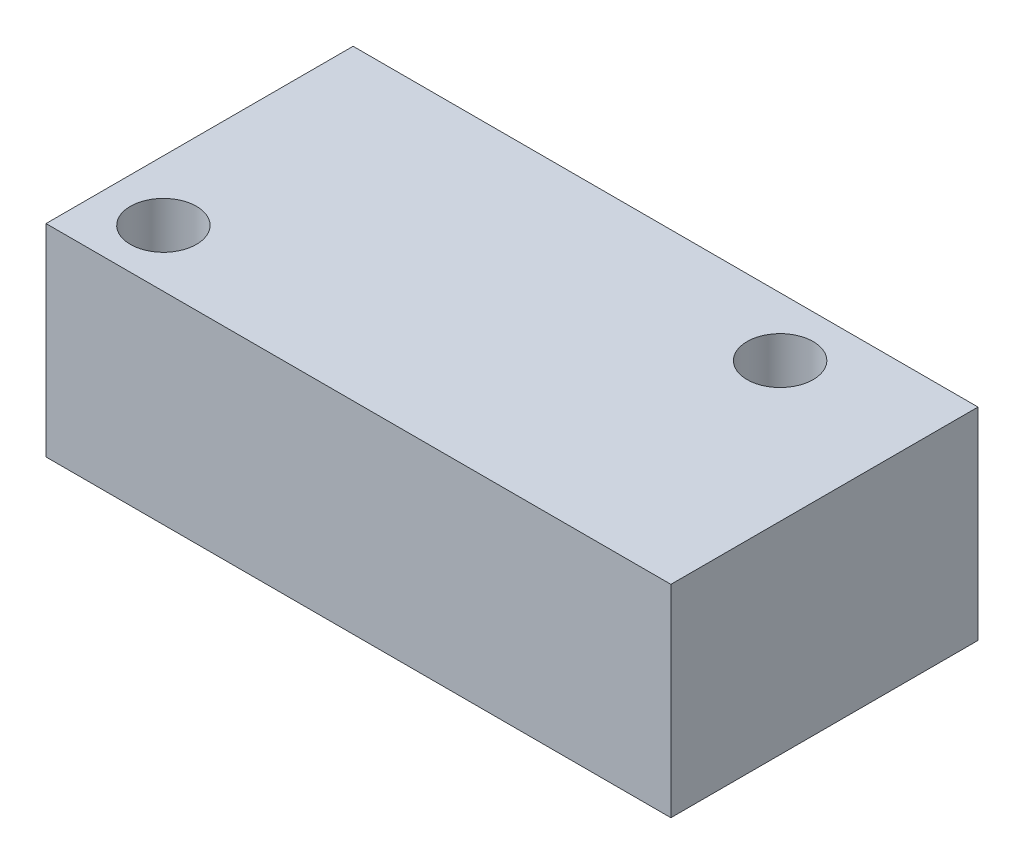
from build123d import *

# Parameters (mm, degrees)
SKETCH2_W           = 32.15
SKETCH2_H           = 15.8
BOSS_EXTRUDE1_DEPTH = 10.4
SKETCH3_R           = 1.7
CUT_EXTRUDE1_DEPTH  = 10.4


with BuildPart() as part:
    # Sketch2 → Boss-Extrude1 (new body)
    with BuildSketch(Plane(origin=(0, 0, 0), x_dir=(1, 0, 0), z_dir=(0, 1, 0))):
        with Locations((16.075, 7.9)):
            Rectangle(SKETCH2_W, SKETCH2_H)
    extrude(amount=BOSS_EXTRUDE1_DEPTH)

    # Sketch3 → Cut-Extrude1 (cut)
    with BuildSketch(Plane(origin=(0, 10.4, 0), x_dir=(1, 0, 0), z_dir=(0, 1, 0))):
        with Locations((3.1, 2.94)):
            Circle(SKETCH3_R)
        with Locations((24.99, 12.78)):
            Circle(SKETCH3_R)
    extrude(amount=-CUT_EXTRUDE1_DEPTH, mode=Mode.SUBTRACT)

    # Sketch13 → Revolve1 (revolve)
    with BuildSketch(Plane(origin=(0, 5.2, 0), x_dir=(1, 0, 0), z_dir=(0, 1, 0))):
        with BuildLine():
            Line((4.870191612, 15.8), (9.470191612, 15.8))
            ThreePointArc((9.470191612, 15.8), (8.487581187, 16.827034892), (7.12986911, 17.247679442))
            Line((7.12986911, 17.247679442), (7.12986911, 17.847679442))
            ThreePointArc((7.12986911, 17.847679442), (6.138456674, 18.695290943), (4.870191612, 19))
            Line((4.870191612, 19), (4.870191612, 15.8))
        make_face()
    revolve(axis=Axis((4.870191612, 5.2, -15.8), (0, 0, -1)))


solid = part.part
